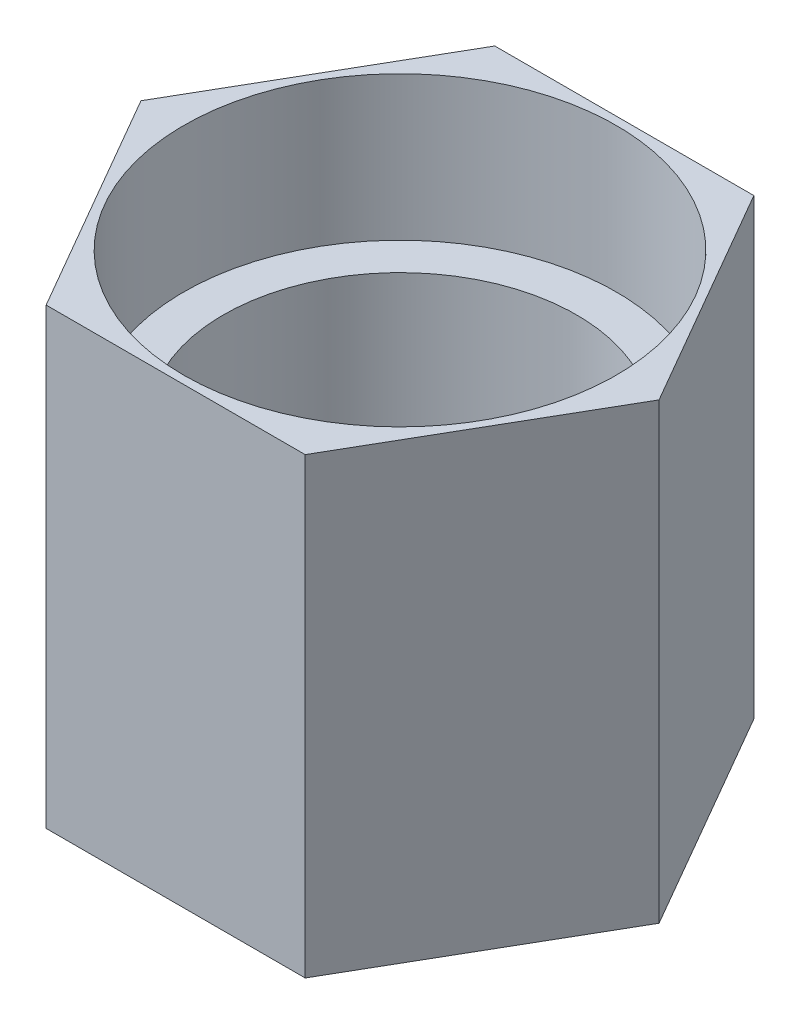
from build123d import *

# Parameters (mm, degrees)
BOSS_EXTRUDE1_DEPTH      = 6.2865
BOSS_EXTRUDE1_DEPTH_BACK = 6.2865
SKETCH1_R                = 6
BOSS_EXTRUDE2_DEPTH      = 2.2865
BOSS_EXTRUDE2_DEPTH_BACK = 2.2865
SKETCH2_R                = 6
SKETCH2_R_2              = 4.9


with BuildPart() as part:
    # Sketch1 → Boss-Extrude1 (new, two sides: drawn at the far end of the back side and taken through both)
    with BuildSketch(Plane(origin=(0, 0, 0), x_dir=(1, 0, 0), z_dir=(0, 1, 0)).offset(-BOSS_EXTRUDE1_DEPTH_BACK)):
        Polygon((-3.592850725, 6.223), (-7.18570145, 0), (-3.592850725, -6.223), (3.592850725, -6.223), (7.18570145, 0), (3.592850725, 6.223), align=None)
        Circle(SKETCH1_R, mode=Mode.SUBTRACT)
    extrude(amount=BOSS_EXTRUDE1_DEPTH + BOSS_EXTRUDE1_DEPTH_BACK)

    # Sketch2 → Boss-Extrude2 (add, two sides: drawn at the far end of the back side and taken through both)
    with BuildSketch(Plane(origin=(0, 0, 0), x_dir=(1, 0, 0), z_dir=(0, 1, 0)).offset(-BOSS_EXTRUDE2_DEPTH_BACK)):
        Circle(SKETCH2_R)
        Circle(SKETCH2_R_2, mode=Mode.SUBTRACT)
    extrude(amount=BOSS_EXTRUDE2_DEPTH + BOSS_EXTRUDE2_DEPTH_BACK)


solid = part.part
